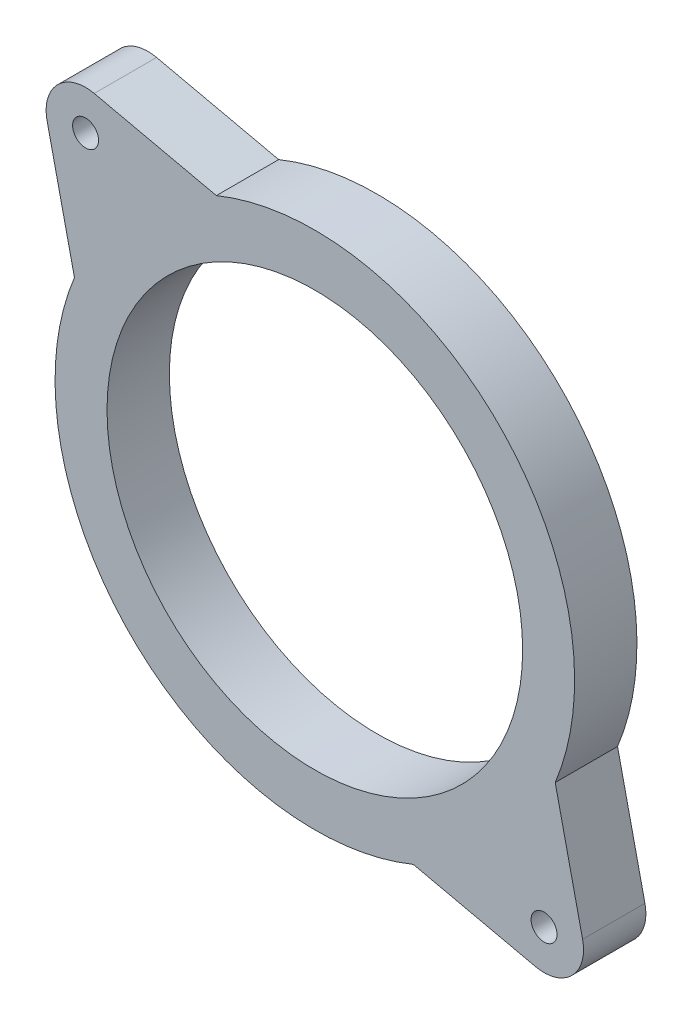
from build123d import *

# Parameters (mm, degrees)
SKETCH_1_R        = 20
EXTRUDE_1_DEPTH   = 6
HOLE_WIZARD_M31_D = 2.5


with BuildPart() as part:
    # Эскиз1 → Бобышка-Вытянуть1 (new body)
    with BuildSketch(Plane.XY):
        with BuildLine():
            Line((9.476919675, -23.134130489), (21.23028272, -25.76965455))
            ThreePointArc((21.23028272, -25.76965455), (24.748737342, -24.748737342), (25.76965455, -21.23028272))
            Line((25.76965455, -21.23028272), (23.134130489, -9.476919675))
            ThreePointArc((23.134130489, -9.476919675), (17.67766953, 17.67766953), (-9.476919675, 23.134130489))
            Line((-9.476919675, 23.134130489), (-21.23028272, 25.76965455))
            ThreePointArc((-21.23028272, 25.76965455), (-24.748737342, 24.748737342), (-25.76965455, 21.23028272))
            Line((-25.76965455, 21.23028272), (-23.134130489, 9.476919675))
            ThreePointArc((-23.134130489, 9.476919675), (-17.67766953, -17.67766953), (9.476919675, -23.134130489))
        make_face()
        Circle(SKETCH_1_R, mode=Mode.SUBTRACT)
    extrude(amount=EXTRUDE_1_DEPTH)

    # Отверстие обработанное метчиком M31 (through all)
    with Locations(Plane.XY.offset(6)):
        with Locations((-22.061731573, 22.061731573), (22.061731573, -22.061731573)):
            Hole(HOLE_WIZARD_M31_D / 2)


solid = part.part
